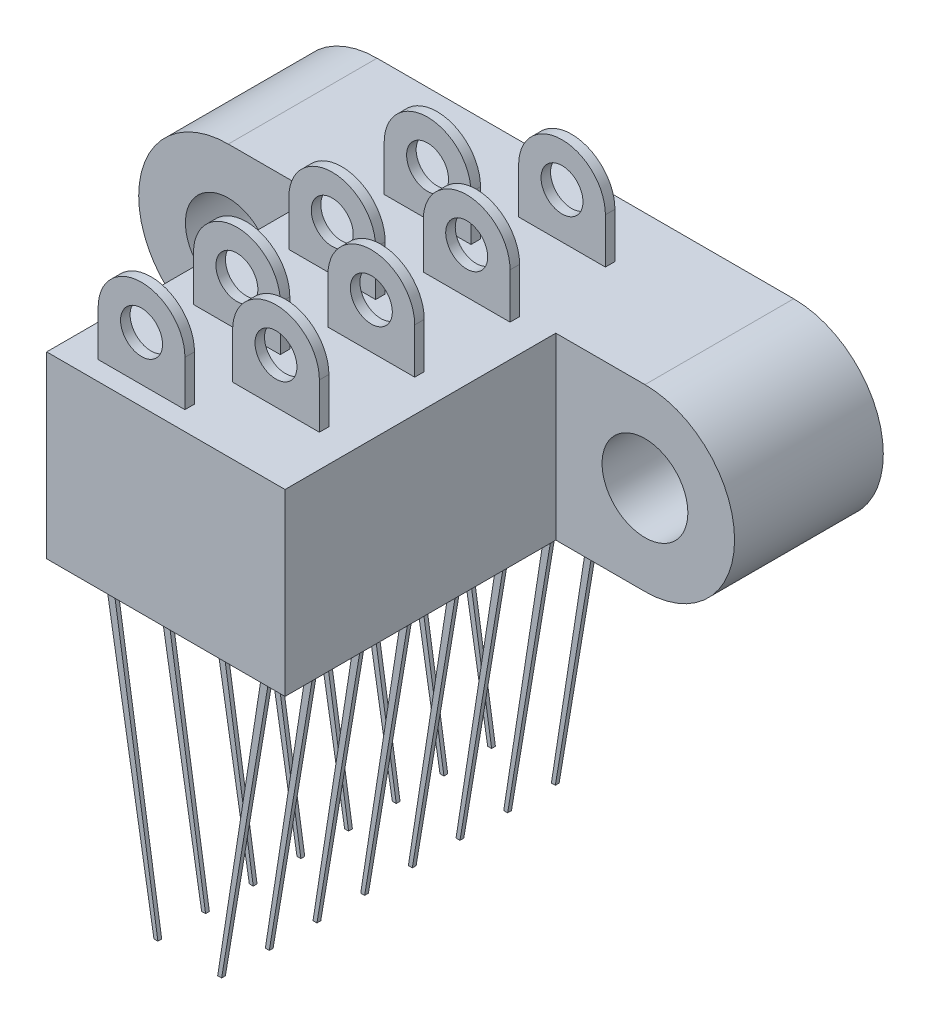
from build123d import *

# Parameters (mm, degrees)
SKETCH1_R                 = 1.143
BOSS_EXTRUDE1_DEPTH       = 3.9624
SKETCH2_W                 = 6.35
SKETCH2_H                 = 4.7752
BOSS_EXTRUDE2_DEPTH       = 7.2136
BOSS_EXTRUDE3_DEPTH       = 0.127
BOSS_EXTRUDE3_DEPTH_BACK  = 0.127
SKETCH3_R                 = 0.5588
BOSS_EXTRUDE4_DEPTH       = 0.127
BOSS_EXTRUDE4_DEPTH_BACK  = 0.127
SKETCH4_R                 = 0.5588
BOSS_EXTRUDE5_DEPTH       = 0.127
BOSS_EXTRUDE5_DEPTH_BACK  = 0.127
SKETCH5_R                 = 0.5588
BOSS_EXTRUDE6_DEPTH       = 0.127
BOSS_EXTRUDE6_DEPTH_BACK  = 0.127
SKETCH7_R                 = 0.5588
BOSS_EXTRUDE7_DEPTH       = 0.127
BOSS_EXTRUDE7_DEPTH_BACK  = 0.127
SKETCH6_R                 = 0.5588
BOSS_EXTRUDE8_DEPTH       = 0.0508
BOSS_EXTRUDE8_DEPTH_BACK  = 0.0508
BOSS_EXTRUDE11_DEPTH      = 0.0508
BOSS_EXTRUDE11_DEPTH_BACK = 0.0508
BOSS_EXTRUDE12_DEPTH      = 0.0508
BOSS_EXTRUDE12_DEPTH_BACK = 0.0508
BOSS_EXTRUDE13_DEPTH      = 0.0508
BOSS_EXTRUDE13_DEPTH_BACK = 0.0508
BOSS_EXTRUDE14_DEPTH      = 0.0508
BOSS_EXTRUDE14_DEPTH_BACK = 0.0508
BOSS_EXTRUDE15_DEPTH      = 0.0508
BOSS_EXTRUDE15_DEPTH_BACK = 0.0508
BOSS_EXTRUDE16_DEPTH      = 0.0508
BOSS_EXTRUDE16_DEPTH_BACK = 0.0508
BOSS_EXTRUDE17_DEPTH      = 0.0508
BOSS_EXTRUDE17_DEPTH_BACK = 0.0508
BOSS_EXTRUDE18_DEPTH      = 0.127
BOSS_EXTRUDE18_DEPTH_BACK = 0.127
SKETCH16_R                = 0.5588
BOSS_EXTRUDE19_DEPTH      = 0.127
BOSS_EXTRUDE19_DEPTH_BACK = 0.127
SKETCH18_R                = 0.5588
BOSS_EXTRUDE20_DEPTH      = 0.127
BOSS_EXTRUDE20_DEPTH_BACK = 0.127
SKETCH17_R                = 0.5588


with BuildPart() as part:
    # Sketch1 → Boss-Extrude1 (new body)
    with BuildSketch(Plane.XY):
        with BuildLine():
            Line((-5.5499, 2.3876), (5.5499, 2.3876))
            ThreePointArc((5.5499, 2.3876), (7.9375, 0), (5.5499, -2.3876))
            Line((5.5499, -2.3876), (-5.5499, -2.3876))
            ThreePointArc((-5.5499, -2.3876), (-7.9375, 0), (-5.5499, 2.3876))
        make_face()
        with Locations((-5.5499, 0)):
            Circle(SKETCH1_R, mode=Mode.SUBTRACT)
        with Locations((5.5499, 0)):
            Circle(SKETCH1_R, mode=Mode.SUBTRACT)
    extrude(amount=BOSS_EXTRUDE1_DEPTH)

    # Sketch2 → Boss-Extrude2 (add)
    with BuildSketch(Plane.XY.offset(3.9624)):
        Rectangle(SKETCH2_W, SKETCH2_H)
    extrude(amount=BOSS_EXTRUDE2_DEPTH)

    # Sketch3 → Boss-Extrude3 (add, two sides: drawn at the far end of the back side and taken through both)
    with BuildSketch(Plane(origin=(0, 0, 1.651), x_dir=(-1, 0, 0), z_dir=(0, 0, -1)).offset(-BOSS_EXTRUDE3_DEPTH_BACK)):
        with BuildLine():
            Line((-2.3114, 3.5941), (-2.3114, 2.3876))
            Line((-2.3114, 2.3876), (0, 2.3876))
            Line((0, 2.3876), (0, 3.5941))
            ThreePointArc((0, 3.5941), (-1.1557, 4.7498), (-2.3114, 3.5941))
        make_face()
        with Locations((-1.1557, 3.5941)):
            Circle(SKETCH3_R, mode=Mode.SUBTRACT)
    extrude(amount=BOSS_EXTRUDE3_DEPTH + BOSS_EXTRUDE3_DEPTH_BACK)

    # Sketch4 → Boss-Extrude4 (add, two sides: drawn at the far end of the back side and taken through both)
    with BuildSketch(Plane(origin=(0, 0, 2.921), x_dir=(-1, 0, 0), z_dir=(0, 0, -1)).offset(-BOSS_EXTRUDE4_DEPTH_BACK)):
        with BuildLine():
            Line((2.3114, 3.5941), (2.3114, 2.3876))
            Line((2.3114, 2.3876), (0, 2.3876))
            Line((0, 2.3876), (0, 3.5941))
            ThreePointArc((0, 3.5941), (1.1557, 4.7498), (2.3114, 3.5941))
        make_face()
        with Locations((1.1557, 3.5941)):
            Circle(SKETCH4_R, mode=Mode.SUBTRACT)
    extrude(amount=BOSS_EXTRUDE4_DEPTH + BOSS_EXTRUDE4_DEPTH_BACK)

    # Sketch5 → Boss-Extrude5 (add, two sides: drawn at the far end of the back side and taken through both)
    with BuildSketch(Plane(origin=(0, 0, 4.191), x_dir=(-1, 0, 0), z_dir=(0, 0, -1)).offset(-BOSS_EXTRUDE5_DEPTH_BACK)):
        with BuildLine():
            Line((-2.3114, 3.5941), (-2.3114, 2.3876))
            Line((-2.3114, 2.3876), (0, 2.3876))
            Line((0, 2.3876), (0, 3.5941))
            ThreePointArc((0, 3.5941), (-1.1557, 4.7498), (-2.3114, 3.5941))
        make_face()
        with Locations((-1.1557, 3.5941)):
            Circle(SKETCH5_R, mode=Mode.SUBTRACT)
    extrude(amount=BOSS_EXTRUDE5_DEPTH + BOSS_EXTRUDE5_DEPTH_BACK)

    # Sketch7 → Boss-Extrude6 (add, two sides: drawn at the far end of the back side and taken through both)
    with BuildSketch(Plane(origin=(0, 0, 5.461), x_dir=(-1, 0, 0), z_dir=(0, 0, -1)).offset(-BOSS_EXTRUDE6_DEPTH_BACK)):
        with BuildLine():
            Line((2.3114, 2.3876), (2.3114, 3.5941))
            ThreePointArc((2.3114, 3.5941), (1.1557, 4.7498), (0, 3.5941))
            Line((0, 3.5941), (0, 2.3876))
            Line((0, 2.3876), (2.3114, 2.3876))
        make_face()
        with Locations((1.1557, 3.5941)):
            Circle(SKETCH7_R, mode=Mode.SUBTRACT)
    extrude(amount=BOSS_EXTRUDE6_DEPTH + BOSS_EXTRUDE6_DEPTH_BACK)

    # Sketch6 → Boss-Extrude7 (add, two sides: drawn at the far end of the back side and taken through both)
    with BuildSketch(Plane(origin=(0, 0, 6.731), x_dir=(-1, 0, 0), z_dir=(0, 0, -1)).offset(-BOSS_EXTRUDE7_DEPTH_BACK)):
        with BuildLine():
            Line((-2.3114, 3.5941), (-2.3114, 2.3876))
            Line((-2.3114, 2.3876), (0, 2.3876))
            Line((0, 2.3876), (0, 3.5941))
            ThreePointArc((0, 3.5941), (-1.1557, 4.7498), (-2.3114, 3.5941))
        make_face()
        with Locations((-1.1557, 3.5941)):
            Circle(SKETCH6_R, mode=Mode.SUBTRACT)
    extrude(amount=BOSS_EXTRUDE7_DEPTH + BOSS_EXTRUDE7_DEPTH_BACK)

    # Sketch8 → Boss-Extrude8 (add, two sides: drawn at the far end of the back side and taken through both)
    with BuildSketch(Plane(origin=(0, 0, 1.651), x_dir=(-1, 0, 0), z_dir=(0, 0, -1)).offset(-BOSS_EXTRUDE8_DEPTH_BACK)):
        Polygon((2.228681211, -2.3876), (2.028101851, -2.3876), (0.796265448, -10.3124), (0.900870757, -10.3124), align=None)
        Polygon((-0.900870757, -10.3124), (-0.796265448, -10.3124), (-2.028101851, -2.3876), (-2.228681211, -2.3876), align=None)
    extrude(amount=BOSS_EXTRUDE8_DEPTH + BOSS_EXTRUDE8_DEPTH_BACK)

    # Sketch11 → Boss-Extrude11 (add, two sides: drawn at the far end of the back side and taken through both)
    with BuildSketch(Plane(origin=(0, 0, 4.191), x_dir=(-1, 0, 0), z_dir=(0, 0, -1)).offset(-BOSS_EXTRUDE11_DEPTH_BACK)):
        Polygon((2.228681211, -2.3876), (0.900870757, -10.3124), (0.796265448, -10.3124), (2.028101851, -2.3876), align=None)
        Polygon((-0.900870757, -10.3124), (-0.796265448, -10.3124), (-2.028101851, -2.3876), (-2.228681211, -2.3876), align=None)
    extrude(amount=BOSS_EXTRUDE11_DEPTH + BOSS_EXTRUDE11_DEPTH_BACK)

    # Sketch12 → Boss-Extrude12 (add, two sides: drawn at the far end of the back side and taken through both)
    with BuildSketch(Plane(origin=(0, 0, 6.731), x_dir=(-1, 0, 0), z_dir=(0, 0, -1)).offset(-BOSS_EXTRUDE12_DEPTH_BACK)):
        Polygon((2.228681211, -2.3876), (0.900870757, -10.3124), (0.796265448, -10.3124), (2.028101851, -2.3876), align=None)
        Polygon((-0.900870757, -10.3124), (-0.796265448, -10.3124), (-2.028101851, -2.3876), (-2.228681211, -2.3876), align=None)
    extrude(amount=BOSS_EXTRUDE12_DEPTH + BOSS_EXTRUDE12_DEPTH_BACK)

    # Sketch13 → Boss-Extrude13 (add, two sides: drawn at the far end of the back side and taken through both)
    with BuildSketch(Plane(origin=(0, 0, 2.921), x_dir=(-1, 0, 0), z_dir=(0, 0, -1)).offset(-BOSS_EXTRUDE13_DEPTH_BACK)):
        Polygon((0.900870757, -10.3124), (0.796265448, -10.3124), (2.028101851, -2.3876), (2.228681211, -2.3876), align=None)
        Polygon((-0.900870757, -10.3124), (-0.796265448, -10.3124), (-2.028101851, -2.3876), (-2.228681211, -2.3876), align=None)
    extrude(amount=BOSS_EXTRUDE13_DEPTH + BOSS_EXTRUDE13_DEPTH_BACK)

    # Sketch15 → Boss-Extrude14 (add, two sides: drawn at the far end of the back side and taken through both)
    with BuildSketch(Plane(origin=(0, 0, 5.461), x_dir=(-1, 0, 0), z_dir=(0, 0, -1)).offset(-BOSS_EXTRUDE14_DEPTH_BACK)):
        Polygon((-0.900870757, -10.3124), (-2.228681211, -2.3876), (-2.028101851, -2.3876), (-0.796265448, -10.3124), align=None)
        Polygon((0.796265448, -10.3124), (0.900870757, -10.3124), (2.228681211, -2.3876), (2.028101851, -2.3876), align=None)
    extrude(amount=BOSS_EXTRUDE14_DEPTH + BOSS_EXTRUDE14_DEPTH_BACK)

    # Sketch21 → Boss-Extrude15 (add, two sides: drawn at the far end of the back side and taken through both)
    with BuildSketch(Plane(origin=(0, 0, 10.541), x_dir=(-1, 0, 0), z_dir=(0, 0, -1)).offset(-BOSS_EXTRUDE15_DEPTH_BACK)):
        Polygon((-2.028101851, -2.3876), (-0.796265448, -10.3124), (-0.900870757, -10.3124), (-2.228681211, -2.3876), align=None)
        Polygon((0.796265448, -10.3124), (0.900870757, -10.3124), (2.228681211, -2.3876), (2.028101851, -2.3876), align=None)
    extrude(amount=BOSS_EXTRUDE15_DEPTH + BOSS_EXTRUDE15_DEPTH_BACK)

    # Sketch20 → Boss-Extrude16 (add, two sides: drawn at the far end of the back side and taken through both)
    with BuildSketch(Plane(origin=(0, 0, 9.271), x_dir=(-1, 0, 0), z_dir=(0, 0, -1)).offset(-BOSS_EXTRUDE16_DEPTH_BACK)):
        Polygon((2.228681211, -2.3876), (0.900870757, -10.3124), (0.796265448, -10.3124), (2.028101851, -2.3876), align=None)
        Polygon((-0.900870757, -10.3124), (-0.796265448, -10.3124), (-2.028101851, -2.3876), (-2.228681211, -2.3876), align=None)
    extrude(amount=BOSS_EXTRUDE16_DEPTH + BOSS_EXTRUDE16_DEPTH_BACK)

    # Sketch19 → Boss-Extrude17 (add, two sides: drawn at the far end of the back side and taken through both)
    with BuildSketch(Plane(origin=(0, 0, 8.001), x_dir=(-1, 0, 0), z_dir=(0, 0, -1)).offset(-BOSS_EXTRUDE17_DEPTH_BACK)):
        Polygon((-2.028101851, -2.3876), (-0.796265448, -10.3124), (-0.900870757, -10.3124), (-2.228681211, -2.3876), align=None)
        Polygon((0.796265448, -10.3124), (0.900870757, -10.3124), (2.228681211, -2.3876), (2.028101851, -2.3876), align=None)
    extrude(amount=BOSS_EXTRUDE17_DEPTH + BOSS_EXTRUDE17_DEPTH_BACK)

    # Sketch16 → Boss-Extrude18 (add, two sides: drawn at the far end of the back side and taken through both)
    with BuildSketch(Plane(origin=(0, 0, 8.001), x_dir=(-1, 0, 0), z_dir=(0, 0, -1)).offset(-BOSS_EXTRUDE18_DEPTH_BACK)):
        with BuildLine():
            Line((2.3114, 2.3876), (2.3114, 3.5941))
            ThreePointArc((2.3114, 3.5941), (1.1557, 4.7498), (0, 3.5941))
            Line((0, 3.5941), (0, 2.3876))
            Line((0, 2.3876), (2.3114, 2.3876))
        make_face()
        with Locations((1.1557, 3.5941)):
            Circle(SKETCH16_R, mode=Mode.SUBTRACT)
    extrude(amount=BOSS_EXTRUDE18_DEPTH + BOSS_EXTRUDE18_DEPTH_BACK)

    # Sketch18 → Boss-Extrude19 (add, two sides: drawn at the far end of the back side and taken through both)
    with BuildSketch(Plane(origin=(0, 0, 10.541), x_dir=(-1, 0, 0), z_dir=(0, 0, -1)).offset(-BOSS_EXTRUDE19_DEPTH_BACK)):
        with BuildLine():
            Line((2.3114, 2.3876), (2.3114, 3.5941))
            ThreePointArc((2.3114, 3.5941), (1.1557, 4.7498), (0, 3.5941))
            Line((0, 3.5941), (0, 2.3876))
            Line((0, 2.3876), (2.3114, 2.3876))
        make_face()
        with Locations((1.1557, 3.5941)):
            Circle(SKETCH18_R, mode=Mode.SUBTRACT)
    extrude(amount=BOSS_EXTRUDE19_DEPTH + BOSS_EXTRUDE19_DEPTH_BACK)

    # Sketch17 → Boss-Extrude20 (add, two sides: drawn at the far end of the back side and taken through both)
    with BuildSketch(Plane(origin=(0, 0, 9.271), x_dir=(-1, 0, 0), z_dir=(0, 0, -1)).offset(-BOSS_EXTRUDE20_DEPTH_BACK)):
        with BuildLine():
            Line((-2.3114, 3.5941), (-2.3114, 2.3876))
            Line((-2.3114, 2.3876), (0, 2.3876))
            Line((0, 2.3876), (0, 3.5941))
            ThreePointArc((0, 3.5941), (-1.1557, 4.7498), (-2.3114, 3.5941))
        make_face()
        with Locations((-1.1557, 3.5941)):
            Circle(SKETCH17_R, mode=Mode.SUBTRACT)
    extrude(amount=BOSS_EXTRUDE20_DEPTH + BOSS_EXTRUDE20_DEPTH_BACK)


solid = part.part
